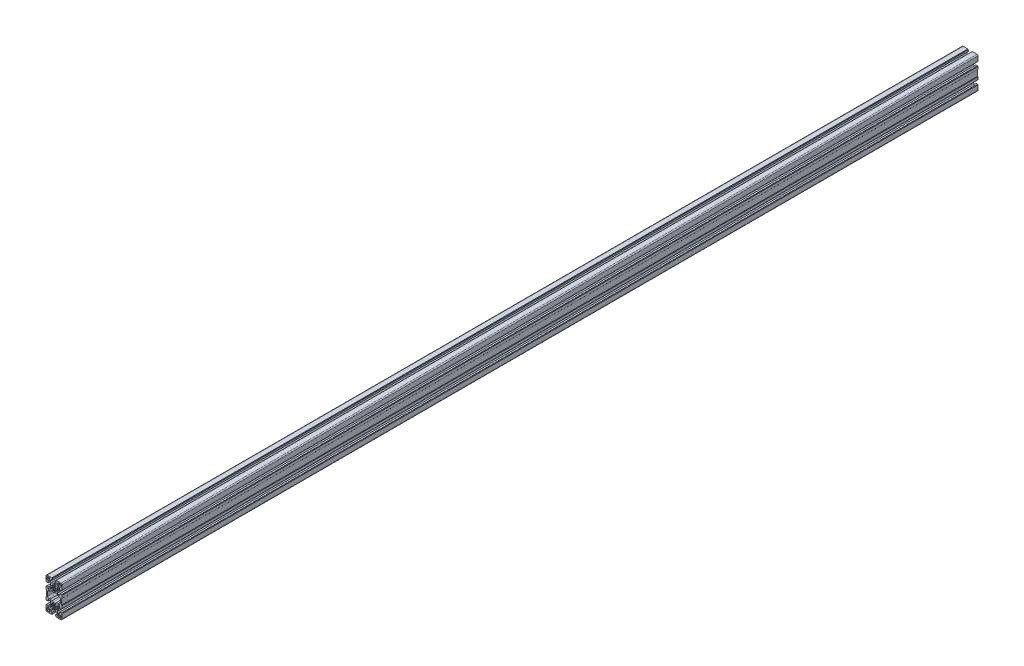
from build123d import *

# Parameters (mm, degrees)
EXTRUDE_1_DEPTH = 2600


with BuildPart() as part:
    # Model → Бобышка-Вытянуть1 (new body)
    with BuildSketch(Plane.XY):
        with BuildLine():
            Line((-9.967141422, -21.690625741), (-9.499938048, -22.499845723))
            Line((-9.499938048, -22.499845723), (-9.967141422, -23.309065705))
            ThreePointArc((-9.967141422, -23.309065705), (-9.80200175, -24.479620156), (-9.499880439, -25.622507529))
            Line((-9.499880439, -25.622507529), (-9.499880439, -29.706850888))
            Line((-9.499880439, -29.706850888), (-12.342840248, -32.549812697))
            Line((-12.342840248, -32.549812697), (-16.499916346, -32.549812697))
            Line((-16.499916346, -32.549812697), (-16.499916346, -27.650316468))
            Line((-16.499916346, -27.650316468), (-20.999900214, -27.650316468))
            Line((-20.999900214, -27.650316468), (-20.999900214, -28.299812932))
            Line((-20.999900214, -28.299812932), (-21.999957629, -28.299812932))
            ThreePointArc((-21.999957629, -28.299812932), (-22.35350973, -28.446258775), (-22.499955837, -28.799810766))
            Line((-22.499955837, -28.799810766), (-22.499955837, -42.000062375))
            ThreePointArc((-22.499955837, -42.000062375), (-21.621279694, -44.121374237), (-19.499967833, -45.00005038))
            Line((-19.499967833, -45.00005038), (-6.300077546, -45.00005038))
            ThreePointArc((-6.300077546, -45.00005038), (-5.94652514, -44.853604463), (-5.800078899, -44.500052192))
            Line((-5.800078899, -44.500052192), (-5.800078899, -43.499934197))
            Line((-5.800078899, -43.499934197), (-5.149983333, -43.499934197))
            Line((-5.149983333, -43.499934197), (-5.149983333, -38.999950328))
            Line((-5.149983333, -38.999950328), (-10.049968467, -38.999950328))
            Line((-10.049968467, -38.999950328), (-10.049968467, -34.84287623))
            Line((-10.049968467, -34.84287623), (-7.207006659, -31.999914421))
            Line((-7.207006659, -31.999914421), (-3.1226653, -31.999914421))
            ThreePointArc((-3.1226653, -31.999914421), (-1.979776956, -32.302035974), (-0.809221508, -32.467175743))
            Line((-0.809221508, -32.467175743), (-1.494e-06, -31.99997235))
            Line((-1.494e-06, -31.99997235), (0.80921852, -32.467175743))
            ThreePointArc((0.80921852, -32.467175743), (1.979773968, -32.302035974), (3.122662312, -31.999914421))
            Line((3.122662312, -31.999914421), (7.206999671, -31.999914421))
            Line((7.206999671, -31.999914421), (10.049961479, -34.84287623))
            Line((10.049961479, -34.84287623), (10.049961479, -38.999950328))
            Line((10.049961479, -38.999950328), (5.150071658, -38.999950328))
            Line((5.150071658, -38.999950328), (5.150071658, -43.499934197))
            Line((5.150071658, -43.499934197), (5.800162754, -43.499934197))
            Line((5.800162754, -43.499934197), (5.800162754, -44.500052172))
            ThreePointArc((5.800162754, -44.500052172), (5.946608597, -44.853604272), (6.300160588, -45.00005038))
            Line((6.300160588, -45.00005038), (19.500057158, -45.00005038))
            ThreePointArc((19.500057158, -45.00005038), (21.621368313, -44.121374529), (22.500044163, -42.000063375))
            Line((22.500044163, -42.000063375), (22.500044163, -28.800070999))
            ThreePointArc((22.500044163, -28.800070999), (22.35359832, -28.446518898), (22.000046329, -28.300072791))
            Line((22.000046329, -28.300072791), (21.00007513, -28.300072791))
            Line((21.00007513, -28.300072791), (21.00007513, -27.650068015))
            Line((21.00007513, -27.650068015), (16.500019948, -27.650068015))
            Line((16.500019948, -27.650068015), (16.500019948, -32.55005715))
            Line((16.500019948, -32.55005715), (12.34294585, -32.55005715))
            Line((12.34294585, -32.55005715), (9.499986041, -29.707095341))
            Line((9.499986041, -29.707095341), (9.499986041, -25.622751982))
            ThreePointArc((9.499986041, -25.622751982), (9.802107352, -24.479864609), (9.967247024, -23.309310159))
            Line((9.967247024, -23.309310159), (9.50004365, -22.500090176))
            Line((9.50004365, -22.500090176), (9.967247024, -21.690870194))
            ThreePointArc((9.967247024, -21.690870194), (9.802107352, -20.520315743), (9.499986041, -19.37742837))
            Line((9.499986041, -19.37742837), (9.499986041, -15.293089012))
            Line((9.499986041, -15.293089012), (12.34294585, -12.450127203))
            Line((12.34294585, -12.450127203), (16.500019948, -12.450127203))
            Line((16.500019948, -12.450127203), (16.500019948, -17.350112338))
            Line((16.500019948, -17.350112338), (20.999974226, -17.350112338))
            Line((20.999974226, -17.350112338), (20.999974226, -16.699997105))
            Line((20.999974226, -16.699997105), (21.999974642, -16.699997105))
            ThreePointArc((21.999974642, -16.699997105), (22.353526742, -16.553551262), (22.499972849, -16.199999271))
            Line((22.499972849, -16.199999271), (22.499972849, -9.250034811))
            ThreePointArc((22.499972849, -9.250034811), (22.353527006, -8.896482711), (21.999975015, -8.750036604))
            Line((21.999975015, -8.750036604), (20.999978226, -8.750036604))
            Line((20.999978226, -8.750036604), (20.999978226, 8.749935845))
            Line((20.999978226, 8.749935845), (21.999974642, 8.749935845))
            ThreePointArc((21.999974642, 8.749935845), (22.353526742, 8.896381688), (22.499972849, 9.249933679))
            Line((22.499972849, 9.249933679), (22.499972849, 16.199898138))
            ThreePointArc((22.499972849, 16.199898138), (22.353527006, 16.553450239), (21.999975015, 16.699896346))
            Line((21.999975015, 16.699896346), (20.999974226, 16.699896346))
            Line((20.999974226, 16.699896346), (20.999974226, 17.350011579))
            Line((20.999974226, 17.350011579), (16.500019948, 17.350011579))
            Line((16.500019948, 17.350011579), (16.500019948, 12.450026444))
            Line((16.500019948, 12.450026444), (12.34294585, 12.450026444))
            Line((12.34294585, 12.450026444), (9.499986041, 15.292988253))
            Line((9.499986041, 15.292988253), (9.499986041, 19.377327611))
            ThreePointArc((9.499986041, 19.377327611), (9.802107352, 20.520214984), (9.967247024, 21.690769435))
            Line((9.967247024, 21.690769435), (9.50004365, 22.499989417))
            Line((9.50004365, 22.499989417), (9.967247024, 23.309209399))
            ThreePointArc((9.967247024, 23.309209399), (9.802107352, 24.47976385), (9.499986041, 25.622651223))
            Line((9.499986041, 25.622651223), (9.499986041, 29.706994582))
            Line((9.499986041, 29.706994582), (12.34294585, 32.54995639))
            Line((12.34294585, 32.54995639), (16.500019948, 32.54995639))
            Line((16.500019948, 32.54995639), (16.500019948, 27.649967256))
            Line((16.500019948, 27.649967256), (21.000003816, 27.649967256))
            Line((21.000003816, 27.649967256), (21.000003816, 28.299972032))
            Line((21.000003816, 28.299972032), (22.000045955, 28.299972032))
            ThreePointArc((22.000045955, 28.299972032), (22.353598056, 28.446417875), (22.500044163, 28.799969866))
            Line((22.500044163, 28.799969866), (22.500044163, 41.999962616))
            ThreePointArc((22.500044163, 41.999962616), (21.621368313, 44.12127377), (19.500057158, 44.99994962))
            Line((19.500057158, 44.99994962), (6.300160962, 44.99994962))
            ThreePointArc((6.300160962, 44.99994962), (5.946608861, 44.853503777), (5.800162754, 44.499951786))
            Line((5.800162754, 44.499951786), (5.800162754, 43.499833437))
            Line((5.800162754, 43.499833437), (5.150071658, 43.499833437))
            Line((5.150071658, 43.499833437), (5.150071658, 38.999849569))
            Line((5.150071658, 38.999849569), (10.049961479, 38.999849569))
            Line((10.049961479, 38.999849569), (10.049961479, 34.842775471))
            Line((10.049961479, 34.842775471), (7.206999671, 31.999813662))
            Line((7.206999671, 31.999813662), (3.122662312, 31.999813662))
            ThreePointArc((3.122662312, 31.999813662), (1.979773968, 32.301935215), (0.80921852, 32.467074984))
            Line((0.80921852, 32.467074984), (-1.494e-06, 31.999871591))
            Line((-1.494e-06, 31.999871591), (-0.809221508, 32.467074984))
            ThreePointArc((-0.809221508, 32.467074984), (-1.979776956, 32.301935215), (-3.1226653, 31.999813662))
            Line((-3.1226653, 31.999813662), (-7.207006659, 31.999813662))
            Line((-7.207006659, 31.999813662), (-10.049968467, 34.842775471))
            Line((-10.049968467, 34.842775471), (-10.049968467, 38.999849569))
            Line((-10.049968467, 38.999849569), (-5.149983333, 38.999849569))
            Line((-5.149983333, 38.999849569), (-5.149983333, 43.499833437))
            Line((-5.149983333, 43.499833437), (-5.800078899, 43.499833437))
            Line((-5.800078899, 43.499833437), (-5.800078899, 44.499952852))
            ThreePointArc((-5.800078899, 44.499952852), (-5.94652548, 44.853504044), (-6.300077087, 44.99994962))
            Line((-6.300077087, 44.99994962), (-19.499967833, 44.99994962))
            ThreePointArc((-19.499967833, 44.99994962), (-21.621279694, 44.121273477), (-22.499955837, 41.999961616))
            Line((-22.499955837, 41.999961616), (-22.499955837, 28.79971038))
            ThreePointArc((-22.499955837, 28.79971038), (-22.353509994, 28.44615828), (-21.999958003, 28.299712173))
            Line((-21.999958003, 28.299712173), (-20.999900214, 28.299712173))
            Line((-20.999900214, 28.299712173), (-20.999900214, 27.650215709))
            Line((-20.999900214, 27.650215709), (-16.499916346, 27.650215709))
            Line((-16.499916346, 27.650215709), (-16.499916346, 32.549711937))
            Line((-16.499916346, 32.549711937), (-12.342840248, 32.549711937))
            Line((-12.342840248, 32.549711937), (-9.499880439, 29.706750129))
            Line((-9.499880439, 29.706750129), (-9.499880439, 25.62240677))
            ThreePointArc((-9.499880439, 25.62240677), (-9.80200175, 24.479519397), (-9.967141422, 23.308964946))
            Line((-9.967141422, 23.308964946), (-9.499938048, 22.499744964))
            Line((-9.499938048, 22.499744964), (-9.967141422, 21.690524982))
            ThreePointArc((-9.967141422, 21.690524982), (-9.80200175, 20.519970531), (-9.499880439, 19.377083158))
            Line((-9.499880439, 19.377083158), (-9.499880439, 15.292739799))
            Line((-9.499880439, 15.292739799), (-12.342840248, 12.449777991))
            Line((-12.342840248, 12.449777991), (-16.499914346, 12.449777991))
            Line((-16.499914346, 12.449777991), (-16.499914346, 17.349763126))
            Line((-16.499914346, 17.349763126), (-20.999898214, 17.349763126))
            Line((-20.999898214, 17.349763126), (-20.999898214, 16.699770756))
            Line((-20.999898214, 16.699770756), (-21.999957629, 16.699770756))
            ThreePointArc((-21.999957629, 16.699770756), (-22.35350973, 16.553324913), (-22.499955837, 16.199772922))
            Line((-22.499955837, 16.199772922), (-22.499955837, 9.249937461))
            ThreePointArc((-22.499955837, 9.249937461), (-22.353509994, 8.896385361), (-21.999958003, 8.749939254))
            Line((-21.999958003, 8.749939254), (-20.999961214, 8.749939254))
            Line((-20.999961214, 8.749939254), (-20.999961214, -8.750040013))
            Line((-20.999961214, -8.750040013), (-21.999957629, -8.750040013))
            ThreePointArc((-21.999957629, -8.750040013), (-22.35350973, -8.896485856), (-22.499955837, -9.250037847))
            Line((-22.499955837, -9.250037847), (-22.499955837, -16.199873307))
            ThreePointArc((-22.499955837, -16.199873307), (-22.353509994, -16.553425408), (-21.999958003, -16.699871515))
            Line((-21.999958003, -16.699871515), (-20.999898214, -16.699871515))
            Line((-20.999898214, -16.699871515), (-20.999898214, -17.349863885))
            Line((-20.999898214, -17.349863885), (-16.499914346, -17.349863885))
            Line((-16.499914346, -17.349863885), (-16.499914346, -12.44987875))
            Line((-16.499914346, -12.44987875), (-12.342840248, -12.44987875))
            Line((-12.342840248, -12.44987875), (-9.499880439, -15.292840559))
            Line((-9.499880439, -15.292840559), (-9.499880439, -19.377183917))
            ThreePointArc((-9.499880439, -19.377183917), (-9.80200175, -20.52007129), (-9.967141422, -21.690625741))
        make_face()
        with BuildLine():
            Line((15.750009243, -42.199948635), (15.40359963, -41.999948952))
            Line((15.40359963, -41.999948952), (13.000018354, -41.999948952))
            ThreePointArc((13.000018354, -41.999948952), (12.292914372, -41.707056738), (12.000022686, -40.999952537))
            Line((12.000022686, -40.999952537), (12.000022686, -35.499971506))
            ThreePointArc((12.000022686, -35.499971506), (12.2929149, -34.792867524), (13.000019101, -34.499975838))
            Line((13.000019101, -34.499975838), (18.500000132, -34.499975838))
            ThreePointArc((18.500000132, -34.499975838), (19.207104114, -34.792868052), (19.4999958, -35.499972253))
            Line((19.4999958, -35.499972253), (19.4999958, -40.999953284))
            ThreePointArc((19.4999958, -40.999953284), (19.207103586, -41.707057266), (18.499999385, -41.999948952))
            Line((18.499999385, -41.999948952), (16.096418856, -41.999948952))
            Line((16.096418856, -41.999948952), (15.750009243, -42.199948635))
        make_face(mode=Mode.SUBTRACT)
        with BuildLine():
            Line((-19.499802395, 35.499871494), (-19.499802395, 40.999852525))
            ThreePointArc((-19.499802395, 40.999852525), (-19.206910181, 41.706956507), (-18.49980598, 41.999848193))
            Line((-18.49980598, 41.999848193), (-12.999824949, 41.999848193))
            ThreePointArc((-12.999824949, 41.999848193), (-12.292720966, 41.706955979), (-11.999829281, 40.999851778))
            Line((-11.999829281, 40.999851778), (-11.999829281, 35.499870747))
            ThreePointArc((-11.999829281, 35.499870747), (-12.292721495, 34.792766764), (-12.999825696, 34.499875078))
            Line((-12.999825696, 34.499875078), (-18.499806727, 34.499875078))
            ThreePointArc((-18.499806727, 34.499875078), (-19.206910709, 34.792767293), (-19.499802395, 35.499871494))
        make_face(mode=Mode.SUBTRACT)
        with BuildLine():
            Line((0.868323598, -17.575984007), (1.389250731, -14.621576598))
            ThreePointArc((1.389250731, -14.621576598), (3.061525623, -15.108999745), (4.588663014, -15.946815973))
            Line((4.588663014, -15.946815973), (2.867939254, -18.404252348))
            ThreePointArc((2.867939254, -18.404252348), (3.535593568, -18.964478604), (4.095821999, -19.632131093))
            Line((4.095821999, -19.632131093), (6.553266123, -17.911414307))
            ThreePointArc((6.553266123, -17.911414307), (7.39108392, -19.438553982), (7.878508442, -21.110831346))
            Line((7.878508442, -21.110831346), (4.924103129, -21.631779638))
            ThreePointArc((4.924103129, -21.631779638), (5.0000631, -22.500012665), (4.924103129, -23.368245693))
            Line((4.924103129, -23.368245693), (7.878513472, -23.889187872))
            ThreePointArc((7.878513472, -23.889187872), (7.391089936, -25.561466994), (6.553272613, -27.08860854))
            Line((6.553272613, -27.08860854), (4.095820978, -25.367895696))
            ThreePointArc((4.095820978, -25.367895696), (3.535599327, -26.035540968), (2.867954055, -26.595762619))
            Line((2.867954055, -26.595762619), (4.588673788, -29.053193813))
            ThreePointArc((4.588673788, -29.053193813), (3.061531918, -29.891017069), (1.389250731, -30.378444733))
            Line((1.389250731, -30.378444733), (0.868323598, -27.424041324))
            ThreePointArc((0.868323598, -27.424041324), (7.1024e-05, -27.500004742), (-0.86818155, -27.424041324))
            Line((-0.86818155, -27.424041324), (-1.389108683, -30.378452733))
            ThreePointArc((-1.389108683, -30.378452733), (-3.061380308, -29.891028506), (-4.588514557, -29.053212444))
            Line((-4.588514557, -29.053212444), (-2.867792798, -26.59577607))
            ThreePointArc((-2.867792798, -26.59577607), (-3.535449757, -26.03554849), (-4.095680178, -25.367893914))
            Line((-4.095680178, -25.367893914), (-6.553133241, -27.088614356))
            ThreePointArc((-6.553133241, -27.088614356), (-7.390950996, -25.561477031), (-7.87837549, -23.889201826))
            Line((-7.87837549, -23.889201826), (-4.923961081, -23.368245693))
            ThreePointArc((-4.923961081, -23.368245693), (-4.999921052, -22.500012665), (-4.923961081, -21.631779638))
            Line((-4.923961081, -21.631779638), (-7.87836949, -21.110830505))
            ThreePointArc((-7.87836949, -21.110830505), (-7.390944996, -19.4385553), (-6.553127241, -17.911417974))
            Line((-6.553127241, -17.911417974), (-4.095682151, -19.632134235))
            ThreePointArc((-4.095682151, -19.632134235), (-3.535455964, -18.964483047), (-2.86780436, -18.404257357))
            Line((-2.86780436, -18.404257357), (-4.588527381, -15.94681518))
            ThreePointArc((-4.588527381, -15.94681518), (-3.061385947, -15.108996916), (-1.389106683, -14.621572598))
            Line((-1.389106683, -14.621572598), (-0.86818155, -17.575984007))
            ThreePointArc((-0.86818155, -17.575984007), (7.1024e-05, -17.500020589), (0.868323598, -17.575984007))
        make_face(mode=Mode.SUBTRACT)
        with BuildLine():
            Line((14.000040862, -9.450121981), (11.05741341, -9.450121981))
            Line((11.05741341, -9.450121981), (7.507402038, -13.000083157))
            Line((7.507402038, -13.000083157), (3.122640756, -13.000083157))
            ThreePointArc((3.122640756, -13.000083157), (0.000157973, -12.500057036), (-3.122333857, -13.000026662))
            Line((-3.122333857, -13.000026662), (-7.507296138, -13.000026662))
            Line((-7.507296138, -13.000026662), (-11.057253412, -9.450067388))
            Line((-11.057253412, -9.450067388), (-13.999886352, -9.450067388))
            ThreePointArc((-13.999886352, -9.450067388), (-16.828302104, -8.278498501), (-17.999868525, -5.450081727))
            Line((-17.999868525, -5.450081727), (-17.999868525, 5.449982951))
            ThreePointArc((-17.999868525, 5.449982951), (-16.828299991, 8.27839835), (-13.999883864, 9.449965124))
            Line((-13.999883864, 9.449965124), (-11.057253412, 9.449965124))
            Line((-11.057253412, 9.449965124), (-7.507296138, 12.999924398))
            Line((-7.507296138, 12.999924398), (-3.122333857, 12.999924398))
            ThreePointArc((-3.122333857, 12.999924398), (0.000157865, 12.49995587), (3.122640282, 12.999982506))
            Line((3.122640282, 12.999982506), (7.507401564, 12.999982506))
            Line((7.507401564, 12.999982506), (11.057412936, 9.45002133))
            Line((11.057412936, 9.45002133), (14.000043852, 9.45002133))
            ThreePointArc((14.000043852, 9.45002133), (16.828498955, 8.2784133), (18.000026524, 5.44992487))
            Line((18.000026524, 5.44992487), (18.000026524, -5.450139309))
            ThreePointArc((18.000026524, -5.450139309), (16.828457667, -8.278555238), (14.000040862, -9.450121981))
        make_face(mode=Mode.SUBTRACT)
        with BuildLine():
            Line((1.389250731, 14.621475839), (0.868323598, 17.575883248))
            ThreePointArc((0.868323598, 17.575883248), (7.1024e-05, 17.49991983), (-0.86818155, 17.575883248))
            Line((-0.86818155, 17.575883248), (-1.389106683, 14.621471839))
            ThreePointArc((-1.389106683, 14.621471839), (-3.061385947, 15.108896156), (-4.588527381, 15.946714421))
            Line((-4.588527381, 15.946714421), (-2.86780436, 18.404156598))
            ThreePointArc((-2.86780436, 18.404156598), (-3.535455964, 18.964382288), (-4.095682151, 19.632033476))
            Line((-4.095682151, 19.632033476), (-6.553127241, 17.911317215))
            ThreePointArc((-6.553127241, 17.911317215), (-7.390944996, 19.43845454), (-7.87836949, 21.110729746))
            Line((-7.87836949, 21.110729746), (-4.923961081, 21.631678879))
            ThreePointArc((-4.923961081, 21.631678879), (-4.999921052, 22.499911906), (-4.923961081, 23.368144934))
            Line((-4.923961081, 23.368144934), (-7.87837549, 23.889101066))
            ThreePointArc((-7.87837549, 23.889101066), (-7.390950996, 25.561376272), (-6.553133241, 27.088513597))
            Line((-6.553133241, 27.088513597), (-4.095680178, 25.367793155))
            ThreePointArc((-4.095680178, 25.367793155), (-3.535449757, 26.035447731), (-2.867792798, 26.59567531))
            Line((-2.867792798, 26.59567531), (-4.588514557, 29.053111685))
            ThreePointArc((-4.588514557, 29.053111685), (-3.061380308, 29.890927747), (-1.389108683, 30.378351974))
            Line((-1.389108683, 30.378351974), (-0.86818155, 27.423940565))
            ThreePointArc((-0.86818155, 27.423940565), (7.1024e-05, 27.499903983), (0.868323598, 27.423940565))
            Line((0.868323598, 27.423940565), (1.389250731, 30.378343974))
            ThreePointArc((1.389250731, 30.378343974), (3.061531533, 29.890915619), (4.588672823, 29.053091676))
            Line((4.588672823, 29.053091676), (2.867954055, 26.59566186))
            ThreePointArc((2.867954055, 26.59566186), (3.535599327, 26.035440209), (4.095820978, 25.367794937))
            Line((4.095820978, 25.367794937), (6.553272613, 27.088507781))
            ThreePointArc((6.553272613, 27.088507781), (7.391089936, 25.561366235), (7.878513472, 23.889087113))
            Line((7.878513472, 23.889087113), (4.924103129, 23.368144934))
            ThreePointArc((4.924103129, 23.368144934), (5.0000631, 22.499911906), (4.924103129, 21.631678879))
            Line((4.924103129, 21.631678879), (7.878508442, 21.110730587))
            ThreePointArc((7.878508442, 21.110730587), (7.39108392, 19.438453223), (6.553266123, 17.911313548))
            Line((6.553266123, 17.911313548), (4.095821999, 19.632030333))
            ThreePointArc((4.095821999, 19.632030333), (3.535593568, 18.964377845), (2.867939254, 18.404151589))
            Line((2.867939254, 18.404151589), (4.588663014, 15.946715214))
            ThreePointArc((4.588663014, 15.946715214), (3.061525623, 15.108898986), (1.389250731, 14.621475839))
        make_face(mode=Mode.SUBTRACT)
        with BuildLine():
            Line((18.499999385, 34.499875078), (13.000018354, 34.499875078))
            ThreePointArc((13.000018354, 34.499875078), (12.292914372, 34.792767293), (12.000022686, 35.499871494))
            Line((12.000022686, 35.499871494), (12.000022686, 40.999852525))
            ThreePointArc((12.000022686, 40.999852525), (12.2929149, 41.706956507), (13.000019101, 41.999848193))
            Line((13.000019101, 41.999848193), (18.500000132, 41.999848193))
            ThreePointArc((18.500000132, 41.999848193), (19.207104114, 41.706955979), (19.4999958, 40.999851778))
            Line((19.4999958, 40.999851778), (19.4999958, 35.499870747))
            ThreePointArc((19.4999958, 35.499870747), (19.207103586, 34.792766764), (18.499999385, 34.499875078))
        make_face(mode=Mode.SUBTRACT)
        with BuildLine():
            Line((-18.49980598, -34.499975838), (-12.999824949, -34.499975838))
            ThreePointArc((-12.999824949, -34.499975838), (-12.292720966, -34.792868052), (-11.999829281, -35.499972253))
            Line((-11.999829281, -35.499972253), (-11.999829281, -40.999953284))
            ThreePointArc((-11.999829281, -40.999953284), (-12.292721495, -41.707057266), (-12.999825696, -41.999948952))
            Line((-12.999825696, -41.999948952), (-18.499806727, -41.999948952))
            ThreePointArc((-18.499806727, -41.999948952), (-19.206910709, -41.707056738), (-19.499802395, -40.999952537))
            Line((-19.499802395, -40.999952537), (-19.499802395, -35.499971506))
            ThreePointArc((-19.499802395, -35.499971506), (-19.206910181, -34.792867524), (-18.49980598, -34.499975838))
        make_face(mode=Mode.SUBTRACT)
    extrude(amount=-EXTRUDE_1_DEPTH)


solid = part.part
